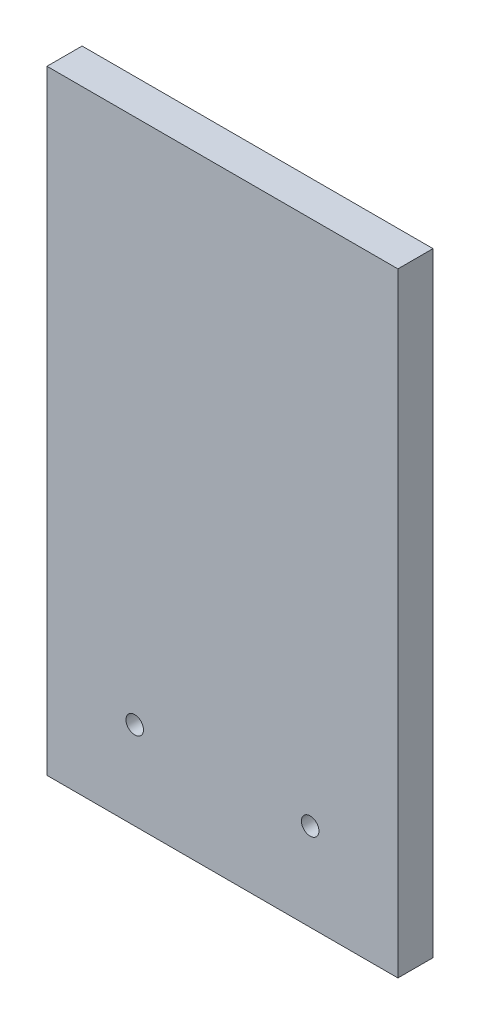
from build123d import *

# Parameters (mm, degrees)
ESBO_O1_W                = 10
ESBO_O1_H                = 17.5
RESSALTO_EXTRUS_O1_DEPTH = 1
ESBO_O2_R                = 0.25
CORTE_EXTRUS_O1_DEPTH    = 122.00481955


with BuildPart() as part:
    # Esboço1 → Ressalto-extrusão1 (new body)
    with BuildSketch(Plane.XY):
        with Locations((90.843569867, 65.109166454)):
            Rectangle(ESBO_O1_W, ESBO_O1_H)
    extrude(amount=RESSALTO_EXTRUS_O1_DEPTH)

    # Esboço2 → Corte-extrusão1 (cut, through all)
    with BuildSketch(Plane.XY.offset(1)):
        with Locations((88.343569867, 58.859166454)):
            Circle(ESBO_O2_R)
        with Locations((93.343569867, 58.859166454)):
            Circle(ESBO_O2_R)
    extrude(amount=-CORTE_EXTRUS_O1_DEPTH, mode=Mode.SUBTRACT)


solid = part.part
